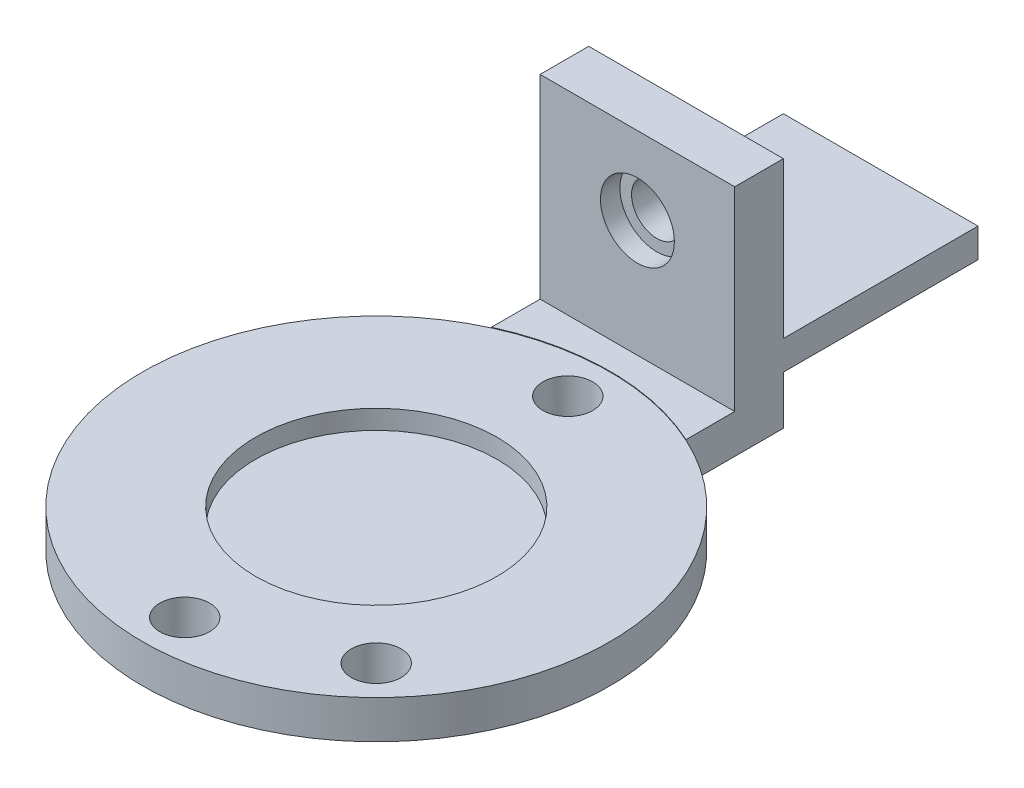
from build123d import *

# Parameters (mm, degrees)
SKETCH1_R           = 30.5
BOSS_EXTRUDE1_DEPTH = 5
SKETCH2_R           = 15.75
CUT_EXTRUDE1_DEPTH  = 2.5
SKETCH3_R           = 15.75
BOSS_EXTRUDE2_DEPTH = 2.5
SKETCH4_R           = 3.25
CUT_EXTRUDE2_DEPTH  = 5.08
SKETCH5_R           = 3.25
CUT_EXTRUDE3_DEPTH  = 5.08
SKETCH6_R           = 3.25
CUT_EXTRUDE4_DEPTH  = 5.08
BOSS_EXTRUDE3_DEPTH = 5.08
SKETCH8_W           = 25.4
SKETCH8_H           = 6.35
BOSS_EXTRUDE4_DEPTH = 25.4
SKETCH9_W           = 25.4
SKETCH9_H           = 3.81
BOSS_EXTRUDE5_DEPTH = 25.4
SKETCH10_R          = 3.302
CUT_EXTRUDE5_DEPTH  = 7.62
SKETCH12_R          = 4.826
CUT_EXTRUDE6_DEPTH  = 2.54


with BuildPart() as part:
    # Sketch1 → Boss-Extrude1 (new body)
    with BuildSketch(Plane(origin=(0, 0, 0), x_dir=(1, 0, 0), z_dir=(0, 1, 0))):
        with Locations(Location((0, 0, 0), (0, 0, 270))):
            Circle(SKETCH1_R)
    extrude(amount=BOSS_EXTRUDE1_DEPTH)

    # Sketch2 → Cut-Extrude1 (cut)
    with BuildSketch(Plane(origin=(0, 5, 0), x_dir=(1, 0, 0), z_dir=(0, 1, 0))):
        with Locations(Location((0, 0, 0), (0, 0, 270))):
            Circle(SKETCH2_R)
    extrude(amount=-CUT_EXTRUDE1_DEPTH, mode=Mode.SUBTRACT)

    # Sketch3 → Boss-Extrude2 (add)
    with BuildSketch(Plane.XZ):
        with Locations(Location((0, 0, 0), (0, 0, 90))):
            Circle(SKETCH3_R)
    extrude(amount=BOSS_EXTRUDE2_DEPTH)

    # Sketch4 → Cut-Extrude2 (cut)
    with BuildSketch(Plane(origin=(0, 0, 0), x_dir=(-1, 0, 0), z_dir=(0, -1, 0))):
        with Locations(Location((0, 25, 0), (0, 0, 90))):
            Circle(SKETCH4_R)
    extrude(amount=-CUT_EXTRUDE2_DEPTH, mode=Mode.SUBTRACT)

    # Sketch5 → Cut-Extrude3 (cut)
    with BuildSketch(Plane.XZ):
        with Locations(Location((0, 25, 0), (0, 0, 270))):
            Circle(SKETCH5_R)
    extrude(amount=-CUT_EXTRUDE3_DEPTH, mode=Mode.SUBTRACT)

    # Sketch6 → Cut-Extrude4 (cut)
    with BuildSketch(Plane.XZ):
        with Locations(Location((17.674476483, 17.680862, 0), (0, 0, 270))):
            Circle(SKETCH6_R)
    extrude(amount=-CUT_EXTRUDE4_DEPTH, mode=Mode.SUBTRACT)

    # Sketch7 → Boss-Extrude3 (add)
    with BuildSketch(Plane.XZ):
        with BuildLine():
            ThreePointArc((12.7, -27.73012802), (6.499272859, -29.79948745), (0, -30.5))
            ThreePointArc((0, -30.5), (-6.499272859, -29.79948745), (-12.7, -27.73012802))
            Line((-12.7, -27.73012802), (-12.7, -40.43012802))
            Line((-12.7, -40.43012802), (12.7, -40.43012802))
            Line((12.7, -40.43012802), (12.7, -27.73012802))
        make_face()
    extrude(amount=-BOSS_EXTRUDE3_DEPTH)

    # Sketch8 → Boss-Extrude4 (add)
    with BuildSketch(Plane(origin=(0, 5.08, 0), x_dir=(1, 0, 0), z_dir=(0, 1, 0))):
        with Locations((0, 37.25512802)):
            Rectangle(SKETCH8_W, SKETCH8_H)
    extrude(amount=BOSS_EXTRUDE4_DEPTH)

    # Sketch9 → Boss-Extrude5 (add)
    with BuildSketch(Plane(origin=(0, 0, -40.43012802), x_dir=(-1, 0, 0), z_dir=(0, 0, -1))):
        with Locations((0, 8.255)):
            Rectangle(SKETCH9_W, SKETCH9_H)
    extrude(amount=BOSS_EXTRUDE5_DEPTH)

    # Sketch10 → Cut-Extrude5 (cut)
    with BuildSketch(Plane(origin=(0, 0, -40.43012802), x_dir=(-1, 0, 0), z_dir=(0, 0, -1))):
        with Locations((0, 20.32)):
            Circle(SKETCH10_R)
    extrude(amount=-CUT_EXTRUDE5_DEPTH, mode=Mode.SUBTRACT)

    # Sketch12 → Cut-Extrude6 (cut)
    with BuildSketch(Plane.XY.offset(-34.08012802)):
        with Locations((0, 20.32)):
            Circle(SKETCH12_R)
    extrude(amount=-CUT_EXTRUDE6_DEPTH, mode=Mode.SUBTRACT)


solid = part.part
